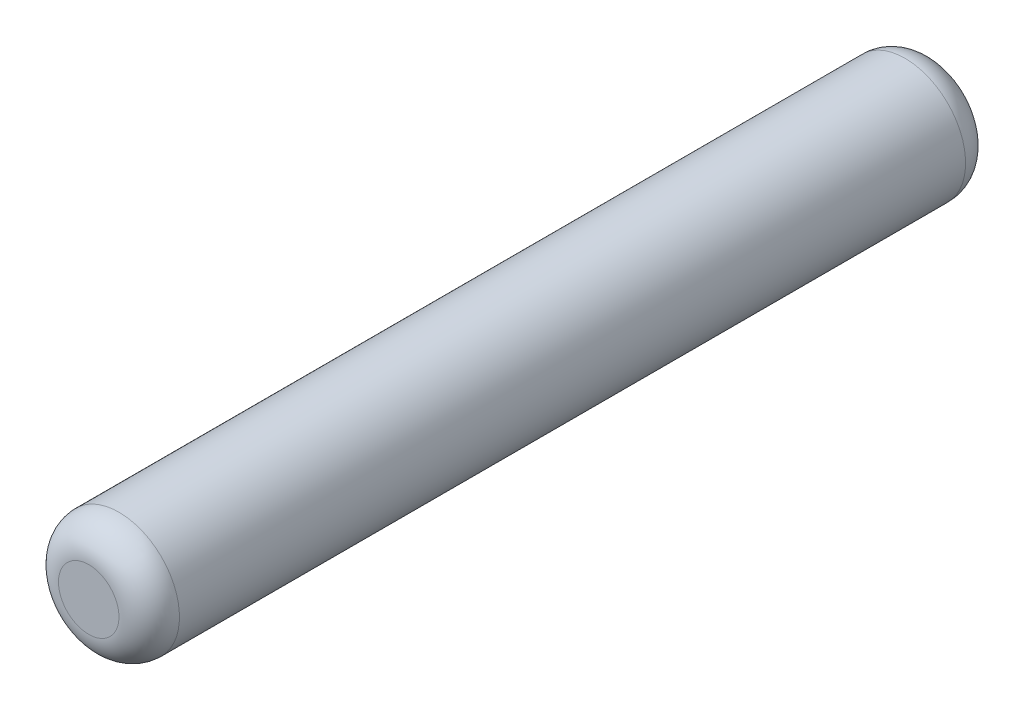
from build123d import *


with BuildPart() as part:
    # Sketch1 → Revolve1 (revolve)
    with BuildSketch(Plane.XZ, mode=Mode.PRIVATE) as revolve1_sk:
        with BuildLine():
            Line((1, 14), (0, 14))
            Line((0, 14), (0, -14))
            Line((0, -14), (1, -14))
            ThreePointArc((1, -14), (1.707106781, -13.707106781), (2, -13))
            Line((2, -13), (2, 13))
            ThreePointArc((2, 13), (1.707106781, 13.707106781), (1, 14))
        make_face()
    revolve(revolve1_sk.sketch.rotate(Axis((0, 0, 14), (0, 0, -1)), 180), axis=Axis((0, 0, 14), (0, 0, -1)))


solid = part.part
